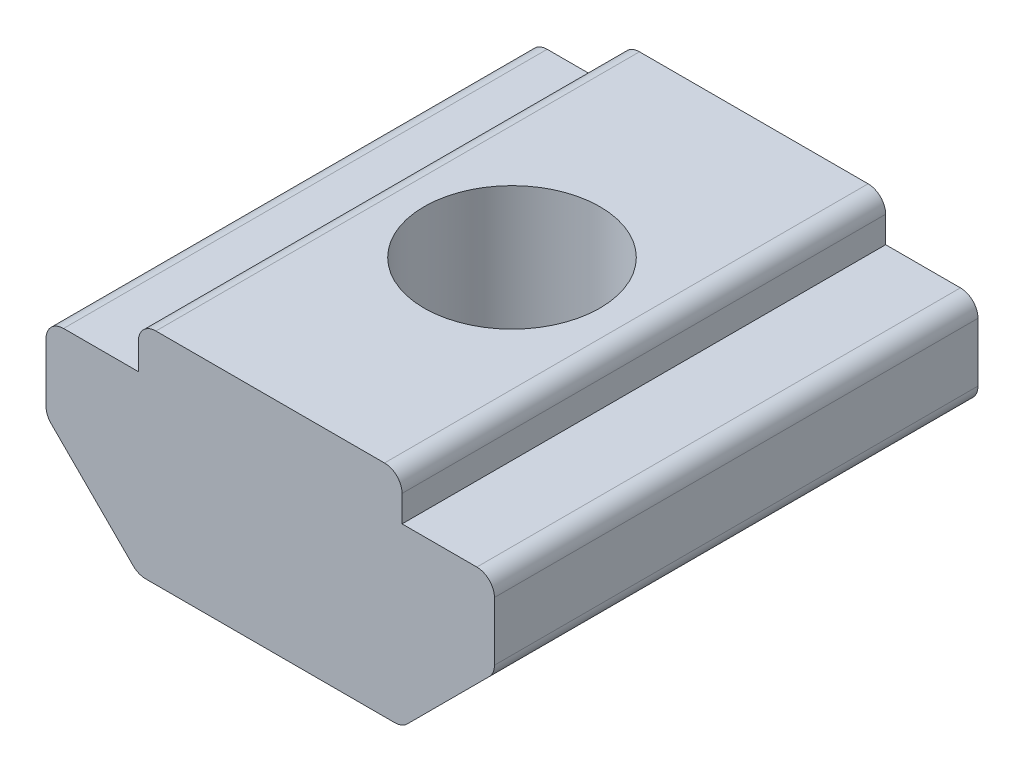
from build123d import *

# Parameters (mm, degrees)
EXTRUDE_1_DEPTH     = 5.5
SKETCH_2_R          = 2
CUT_EXTRUDE_1_DEPTH = 10.014432872
FILLET_1_R          = 0.4


with BuildPart() as part:
    # 草图1 → 凸台-拉伸1 (new, symmetric)
    with BuildSketch(Plane.XY):
        Polygon((-5.1, 0), (-3, 0), (-3, 1), (3, 1), (3, 0), (5.1, 0), (5.1, -1.9), (3, -4), (-3, -4), (-5.1, -1.9), align=None)
    extrude(amount=EXTRUDE_1_DEPTH, both=True)

    # 草图2 → 切除-拉伸1 (cut, through all)
    with BuildSketch(Plane(origin=(0, 1, 0), x_dir=(1, 0, 0), z_dir=(0, 1, 0))):
        with Locations(Location((0, 0, 0), (0, 0, 270))):
            Circle(SKETCH_2_R)
    extrude(amount=-CUT_EXTRUDE_1_DEPTH, mode=Mode.SUBTRACT)

    # 圆角1
    fillet_1_edges = [part.edges().sort_by_distance(p)[0] for p in [
        (-5.1, 0, 0),
        (-3, 1, 0),
        (3, 1, 0),
        (5.1, 0, 0),
        (5.1, -1.9, 0),
        (3, -4, 0),
        (-3, -4, 0),
        (-5.1, -1.9, 0),
    ]]
    fillet(fillet_1_edges, radius=FILLET_1_R)


solid = part.part
